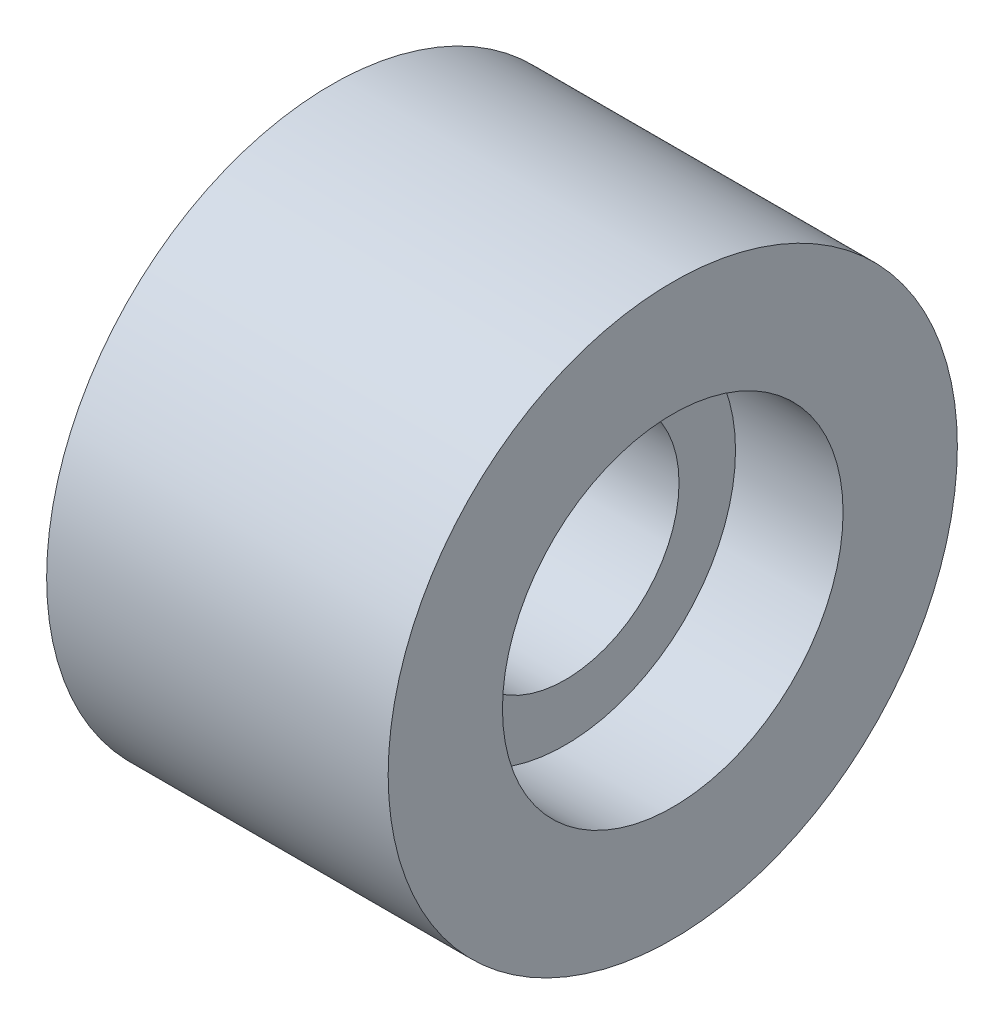
from build123d import *

# Parameters (mm, degrees)
SKETCH1_R           = 15.875
SKETCH1_R_2         = 9.5
BOSS_EXTRUDE1_DEPTH = 6
BOSS_EXTRUDE2_START = -13.050000062
SKETCH1_3_R         = 15.875
SKETCH1_3_R_2       = 6.35
BOSS_EXTRUDE2_DEPTH = 13.050000062


with BuildPart() as part:
    # Sketch1 → Boss-Extrude1 (new body)
    with BuildSketch(Plane(origin=(0, 0, 0), x_dir=(0, 0, -1), z_dir=(1, 0, 0))):
        Circle(SKETCH1_R)
        Circle(SKETCH1_R_2, mode=Mode.SUBTRACT)
    extrude(amount=BOSS_EXTRUDE1_DEPTH)

    # Sketch1<3> → Boss-Extrude2 (add)
    with BuildSketch(Plane(origin=(0, 0, 0), x_dir=(0, 0, -1), z_dir=(1, 0, 0)).offset(BOSS_EXTRUDE2_START)):
        Circle(SKETCH1_3_R)
        Circle(SKETCH1_3_R_2, mode=Mode.SUBTRACT)
    extrude(amount=BOSS_EXTRUDE2_DEPTH)


solid = part.part
